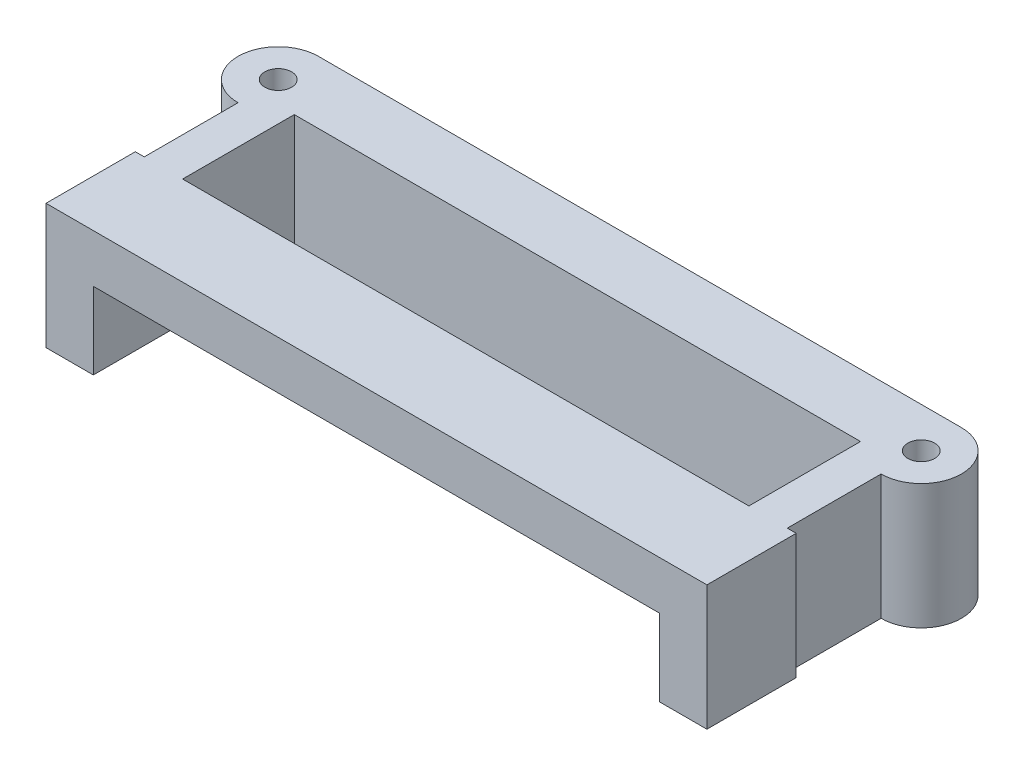
from build123d import *

# Parameters (mm, degrees)
SKETCH_1_R          = 1.5
SKETCH_1_W          = 63.4
SKETCH_1_H          = 12.5
EXTRUDE_1_DEPTH     = 14
SKETCH_2_W          = 63.4
SKETCH_2_H          = 10
CUT_EXTRUDE_1_DEPTH = 8.6


with BuildPart() as part:
    # Эскиз1 → Бобышка-Вытянуть1 (new body)
    with BuildSketch(Plane(origin=(0, 0, 0), x_dir=(1, 0, 0), z_dir=(0, 1, 0))):
        with BuildLine():
            Line((0, 0), (1, 0))
            Line((1, 0), (1, 10.5))
            ThreePointArc((1, 10.5), (-3.5, 15), (1, 19.5))
            Line((1, 19.5), (73, 19.5))
            ThreePointArc((73, 19.5), (77.5, 15), (73, 10.5))
            Line((73, 10.5), (73, 0))
            Line((73, 0), (74, 0))
            Line((74, 0), (74, -10))
            Line((74, -10), (0, -10))
            Line((0, -10), (0, 0))
        make_face()
        with Locations(Location((1, 15, 0), (0, 0, 270))):
            Circle(SKETCH_1_R, mode=Mode.SUBTRACT)
        with Locations(Location((73, 15, 0), (0, 0, 270))):
            Circle(SKETCH_1_R, mode=Mode.SUBTRACT)
        with Locations((37, 6.25)):
            Rectangle(SKETCH_1_W, SKETCH_1_H, mode=Mode.SUBTRACT)
    extrude(amount=EXTRUDE_1_DEPTH)

    # Эскиз2 → Вырез-Вытянуть1 (cut)
    with BuildSketch(Plane.XZ):
        with Locations((37, 5)):
            Rectangle(SKETCH_2_W, SKETCH_2_H)
    extrude(amount=-CUT_EXTRUDE_1_DEPTH, mode=Mode.SUBTRACT)


solid = part.part
